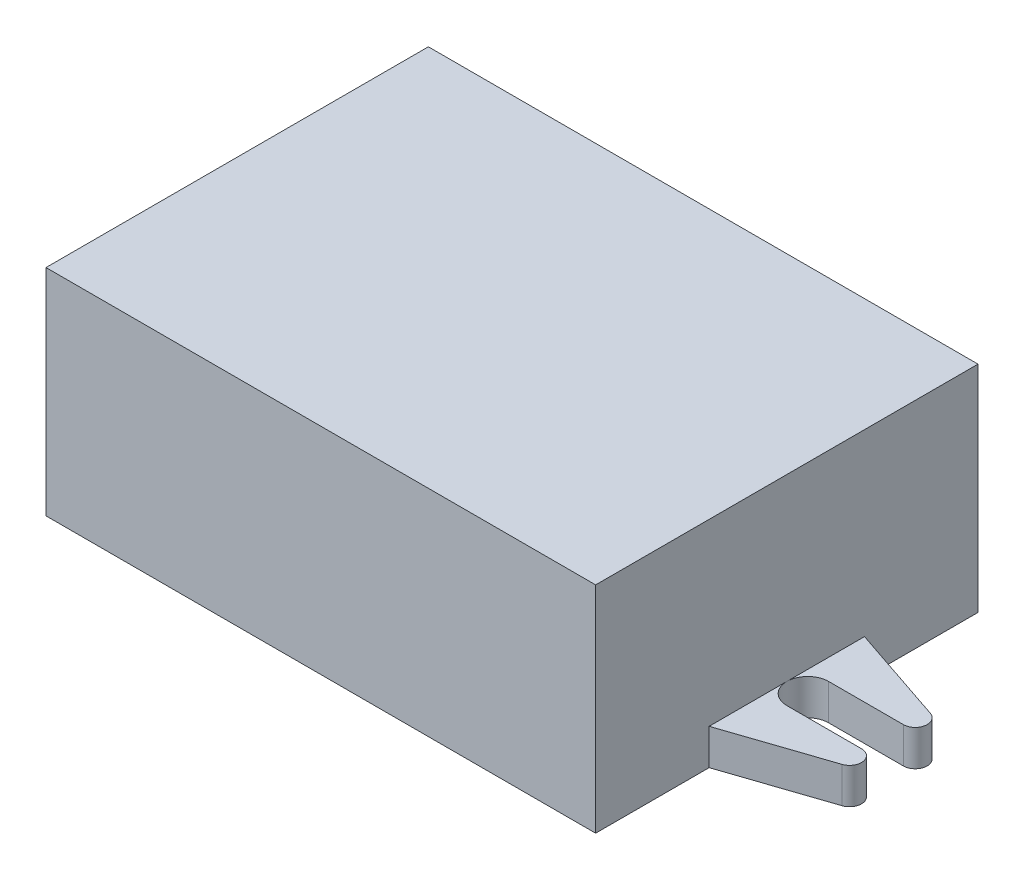
from build123d import *

# Parameters (mm, degrees)
SKETCH1_W           = 46
SKETCH1_H           = 32
BOSS_EXTRUDE1_DEPTH = 18
BOSS_EXTRUDE2_DEPTH = 3


with BuildPart() as part:
    # Sketch1 → Boss-Extrude1 (new body)
    with BuildSketch(Plane(origin=(0, 0, 0), x_dir=(1, 0, 0), z_dir=(0, 1, 0))):
        Rectangle(SKETCH1_W, SKETCH1_H)
    extrude(amount=BOSS_EXTRUDE1_DEPTH)

    # Sketch2 → Boss-Extrude2 (add)
    with BuildSketch(Plane(origin=(0, 0, 0), x_dir=(1, 0, 0), z_dir=(0, 1, 0))):
        with BuildLine():
            Line((-31, 1.75), (-24.75, 1.75))
            ThreePointArc((-24.75, 1.75), (-23.512563133, 1.237436867), (-23, 0))
            Line((-23, 0), (-23, 6.5))
            Line((-23, 6.5), (-31.319224576, 3.697679096))
            ThreePointArc((-31.319224576, 3.697679096), (-31.98683309, 2.58825807), (-31, 1.75))
        make_face()
        with BuildLine():
            Line((-23, -6.5), (-23, 0))
            ThreePointArc((-23, 0), (-23.512563133, -1.237436867), (-24.75, -1.75))
            Line((-24.75, -1.75), (-31, -1.75))
            ThreePointArc((-31, -1.75), (-31.98683309, -2.58825807), (-31.319224576, -3.697679096))
            Line((-31.319224576, -3.697679096), (-23, -6.5))
        make_face()
        with BuildLine():
            Line((31.319224576, 3.697679096), (23, 6.5))
            Line((23, 6.5), (23, 0))
            ThreePointArc((23, 0), (23.512563133, 1.237436867), (24.75, 1.75))
            Line((24.75, 1.75), (31, 1.75))
            ThreePointArc((31, 1.75), (31.98683309, 2.58825807), (31.319224576, 3.697679096))
        make_face()
        with BuildLine():
            ThreePointArc((24.75, -1.75), (23.512563133, -1.237436867), (23, 0))
            Line((23, 0), (23, -6.5))
            Line((23, -6.5), (31.319224576, -3.697679096))
            ThreePointArc((31.319224576, -3.697679096), (31.98683309, -2.58825807), (31, -1.75))
            Line((31, -1.75), (24.75, -1.75))
        make_face()
    extrude(amount=BOSS_EXTRUDE2_DEPTH)


solid = part.part
